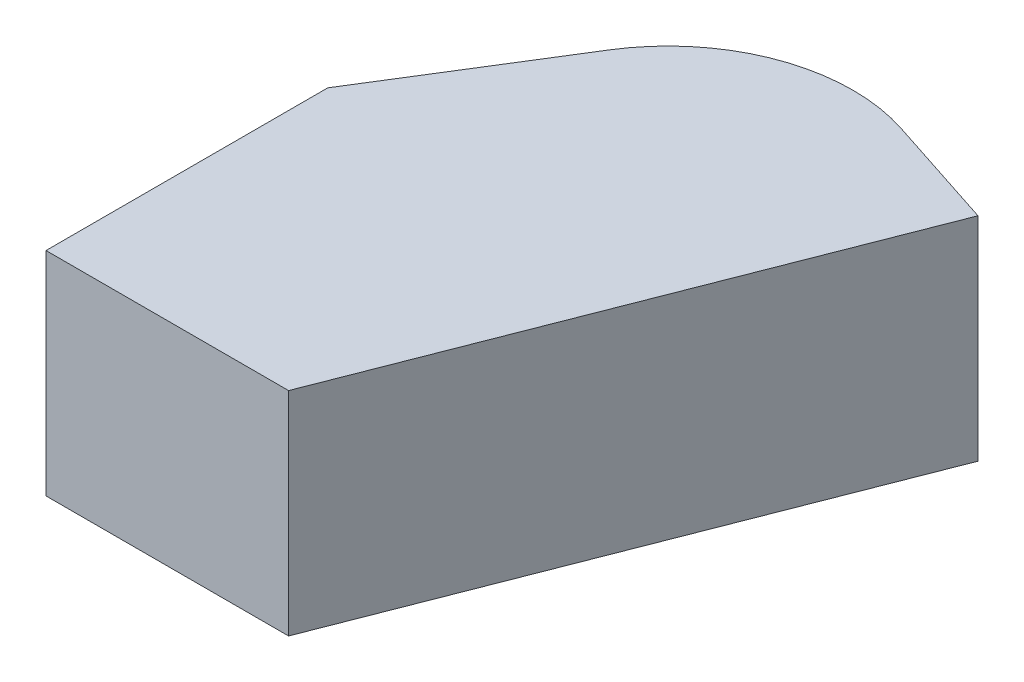
from build123d import *

# Parameters (mm, degrees)
BOSS_EXTRUDE1_DEPTH = 58.42


with BuildPart() as part:
    # Sketch1 → Boss-Extrude1 (new body)
    with BuildSketch(Plane(origin=(0, 0, 0), x_dir=(1, 0, 0), z_dir=(0, 1, 0))):
        with BuildLine():
            Line((-66.673768512, 0), (-37.067821873, 47.633329988))
            ThreePointArc((-37.067821873, 47.633329988), (-11.329209284, 68.541566023), (21.82652777, 69.113940477))
            Line((21.82652777, 69.113940477), (53.138492197, 58.903517294))
            Line((53.138492197, 58.903517294), (0, -77.45185891))
            Line((0, -77.45185891), (-66.673768512, -77.45185891))
            Line((-66.673768512, -77.45185891), (-66.673768512, 0))
        make_face()
    extrude(amount=BOSS_EXTRUDE1_DEPTH)


solid = part.part
